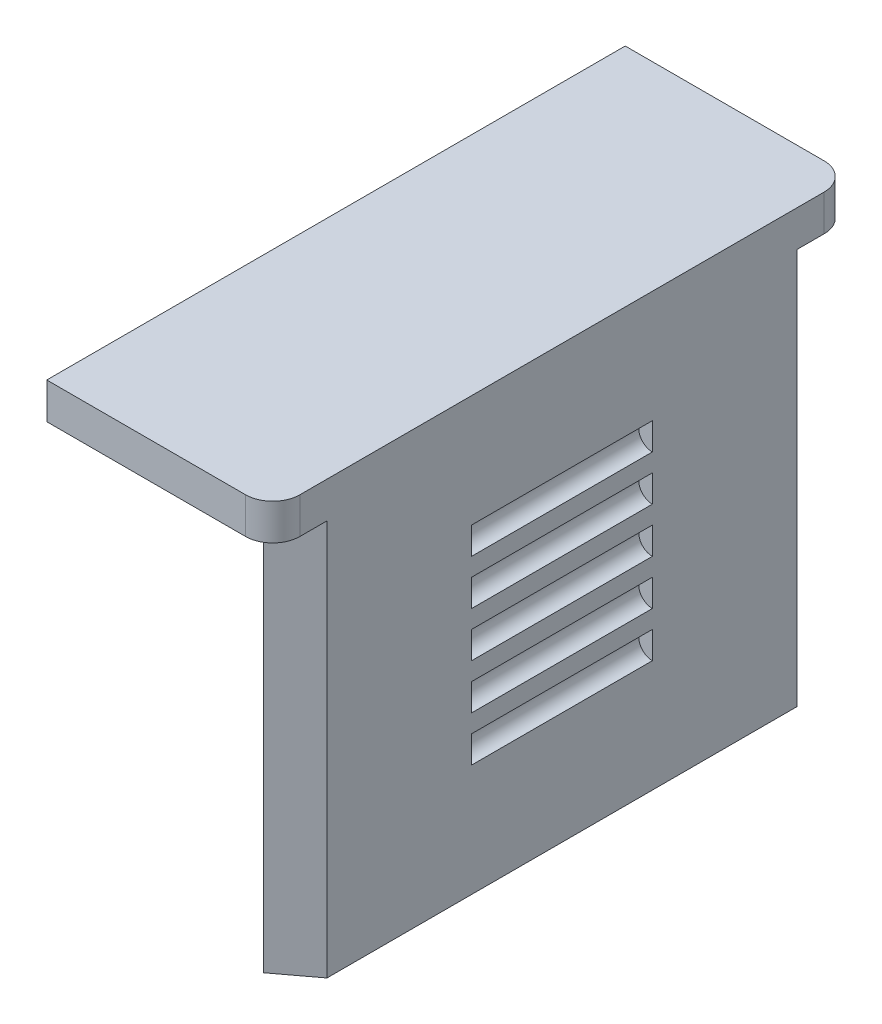
from build123d import *

# Parameters (mm, degrees)
CROQUIS1_W              = 12.5
CROQUIS1_H              = 32
SALIENTE_EXTRUIR1_DEPTH = 2
SALIENTE_EXTRUIR2_DEPTH = 21.9
CROQUIS5_W              = 1
CROQUIS5_H              = 15
SALIENTE_EXTRUIR4_DEPTH = 20
CROQUIS4_R              = 0.75
CORTAR_EXTRUIR1_DEPTH   = 5
REDONDEO1_R             = 1.5


with BuildPart() as part:
    # Croquis1 → Saliente-Extruir1 (new body)
    with BuildSketch(Plane(origin=(0, 111.467949425, 0), x_dir=(1, 0, 0), z_dir=(0, 1, 0))):
        with Locations((-9.702229413, -88.418391236)):
            Rectangle(CROQUIS1_W, CROQUIS1_H)
    extrude(amount=-SALIENTE_EXTRUIR1_DEPTH)

    # Croquis2 → Saliente-Extruir2 (add)
    with BuildSketch(Plane.XZ.offset(-109.467949425)):
        Polygon((-3.452229413, 101.418391236), (-5.452229413, 102.918391236), (-5.452229413, 73.918391236), (-3.452229413, 75.418391236), align=None)
    extrude(amount=SALIENTE_EXTRUIR2_DEPTH)

    # Croquis5 → Saliente-Extruir4 (add)
    with BuildSketch(Plane.XZ.offset(-109.467949425)):
        with Locations((-5.952229413, 88.418391236)):
            Rectangle(CROQUIS5_W, CROQUIS5_H)
    extrude(amount=SALIENTE_EXTRUIR4_DEPTH)

    # Croquis4 → Cortar-Extruir1 (cut, symmetric)
    with BuildSketch(Plane(origin=(0, 0, 88.418391236), x_dir=(0, -1, 0), z_dir=(0, 0, 1))):
        with Locations((-104.517949425, -3.452229413)):
            Circle(CROQUIS4_R)
        with Locations((-102.017949425, -3.452229413)):
            Circle(CROQUIS4_R)
        with Locations((-99.517949425, -3.452229413)):
            Circle(CROQUIS4_R)
        with Locations((-97.017949425, -3.452229413)):
            Circle(CROQUIS4_R)
        with Locations((-94.517949425, -3.452229413)):
            Circle(CROQUIS4_R)
    extrude(amount=CORTAR_EXTRUIR1_DEPTH, both=True, mode=Mode.SUBTRACT)

    # Redondeo1
    redondeo1_edges = [part.edges().sort_by_distance(p)[0] for p in [
        (-3.452229413, 110.467949425, 72.418391236),
        (-3.452229413, 110.467949425, 104.418391236),
    ]]
    fillet(redondeo1_edges, radius=REDONDEO1_R)


solid = part.part
